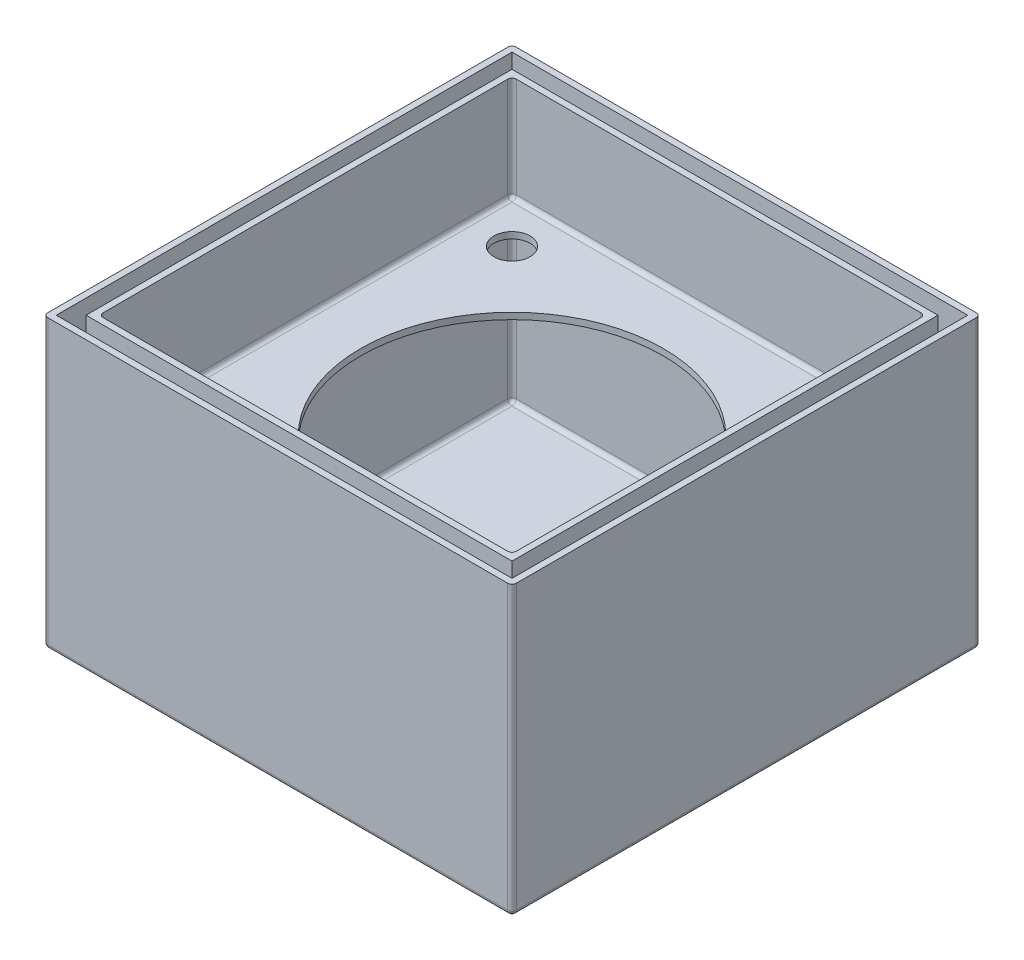
from build123d import *

# Parameters (mm, degrees)
SKETCH1_W             = 200
SKETCH1_H             = 200
SKETCH1_W_2           = 194
SKETCH1_H_2           = 194
BOSS_EXTRUDE1_DEPTH   = 132
SKETCH1_W_3           = 220
SKETCH1_H_3           = 220
SKETCH1_W_4           = 214
SKETCH1_H_4           = 214
BOSS_EXTRUDE1_2_DEPTH = 132
SKETCH3_W             = 220
SKETCH3_H             = 220
BOSS_EXTRUDE3_DEPTH   = 3
SKETCH4_W             = 194
SKETCH4_H             = 194
BOSS_EXTRUDE4_DEPTH   = 3
SKETCH5_R             = 71
CUT_EXTRUDE1_DEPTH    = 3
SKETCH7_R             = 8.5
CUT_EXTRUDE3_DEPTH    = 3
FILLET1_R             = 2


with BuildPart() as part:
    # Sketch1 → Boss-Extrude1 (new body)
    with BuildSketch(Plane(origin=(0, 0, 0), x_dir=(1, 0, 0), z_dir=(0, 1, 0))):
        Rectangle(SKETCH1_W, SKETCH1_H)
        Rectangle(SKETCH1_W_2, SKETCH1_H_2, mode=Mode.SUBTRACT)
    extrude(amount=BOSS_EXTRUDE1_DEPTH)



with BuildPart() as body_2:
    # Sketch1 → Boss-Extrude1 2 (new body)
    with BuildSketch(Plane(origin=(0, 0, 0), x_dir=(1, 0, 0), z_dir=(0, 1, 0))):
        Rectangle(SKETCH1_W_3, SKETCH1_H_3)
        Rectangle(SKETCH1_W_4, SKETCH1_H_4, mode=Mode.SUBTRACT)
    extrude(amount=BOSS_EXTRUDE1_2_DEPTH)


with BuildPart() as part_1:
    add(part.part)

    add(body_2.part)  # Boss-Extrude3 merges body 2
    # Sketch3 → Boss-Extrude3 (add)
    with BuildSketch(Plane.XZ):
        Rectangle(SKETCH3_W, SKETCH3_H)
    extrude(amount=BOSS_EXTRUDE3_DEPTH)

    # Sketch4 → Boss-Extrude4 (add)
    with BuildSketch(Plane(origin=(0, 80, 0), x_dir=(1, 0, 0), z_dir=(0, 1, 0))):
        Rectangle(SKETCH4_W, SKETCH4_H)
    extrude(amount=BOSS_EXTRUDE4_DEPTH)

    # Sketch5 → Cut-Extrude1 (cut)
    with BuildSketch(Plane(origin=(0, 83, 0), x_dir=(1, 0, 0), z_dir=(0, 1, 0))):
        with Locations(Location((0, 0, 0), (0, 0, 270))):
            Circle(SKETCH5_R)
    extrude(amount=-CUT_EXTRUDE1_DEPTH, mode=Mode.SUBTRACT)

    # Sketch7 → Cut-Extrude3 (cut)
    with BuildSketch(Plane(origin=(0, 83, 0), x_dir=(1, 0, 0), z_dir=(0, 1, 0))):
        with Locations(Location((-77, 77, 0), (0, 0, 270))):
            Circle(SKETCH7_R)
    extrude(amount=-CUT_EXTRUDE3_DEPTH, mode=Mode.SUBTRACT)

    # Fillet1
    fillet1_edges = [part_1.edges().sort_by_distance(p)[0] for p in [
        (-97, 0, 0),
        (0, 0, 97),
        (97, 0, 0),
        (0, 0, -97),
        (-97, 107.5, -97),
        (-97, 107.5, 97),
        (97, 107.5, 97),
        (97, 107.5, -97),
        (110, 64.5, -110),
        (110, 64.5, 110),
        (-110, 64.5, 110),
        (-110, 64.5, -110),
        (110, -3, 0),
        (0, -3, 110),
        (-110, -3, 0),
        (0, -3, -110),
        (-97, 40, -97),
        (-97, 40, 97),
        (97, 40, 97),
        (97, 40, -97),
        (97, 83, 0),
        (0, 83, -97),
        (-97, 83, 0),
        (0, 83, 97),
    ]]
    fillet(fillet1_edges, radius=FILLET1_R)


solid = part_1.part
